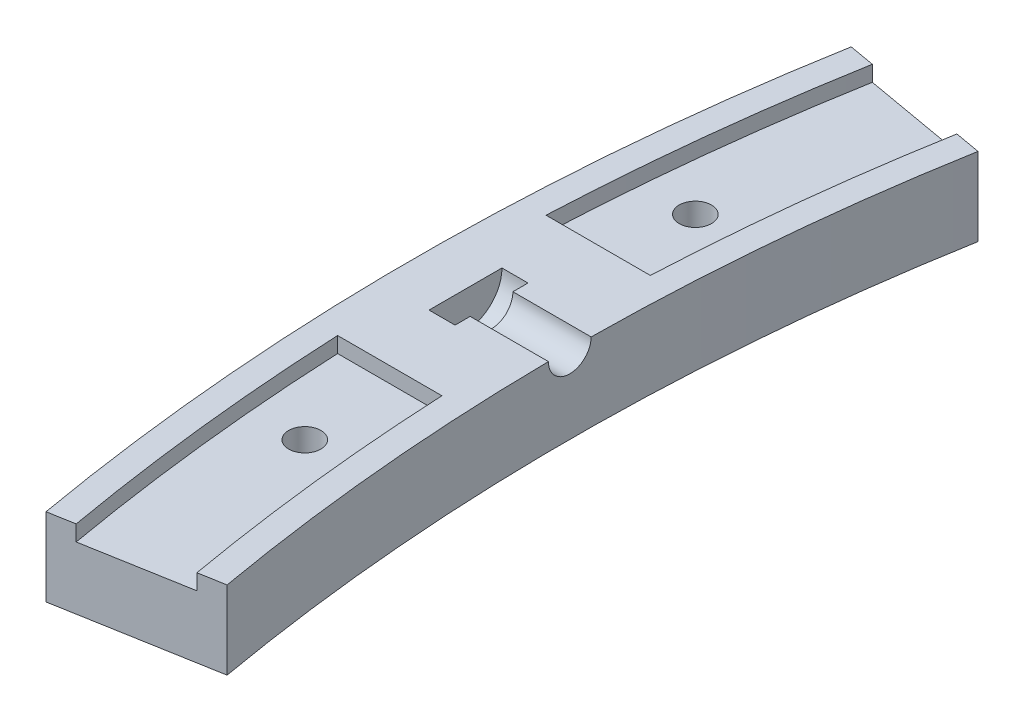
from build123d import *

# Parameters (mm, degrees)
BOSS_EXTRUDE1_DEPTH        = 7.5
CUT_EXTRUDE1_DEPTH         = 1.5
SKETCH4_R                  = 3.5
CUT_EXTRUDE3_DEPTH         = 2.5
SKETCH5_R                  = 2.05
CUT_EXTRUDE4_DEPTH         = 41.774005634
F_3_1_3_1_DIAMETER_HOLE1_D = 3.1


with BuildPart() as part:
    # Sketch1 → Boss-Extrude1 (new body)
    with BuildSketch(Plane(origin=(0, 0, 0), x_dir=(1, 0, 0), z_dir=(0, 1, 0))):
        with BuildLine():
            Line((-219.119725045, 38.636719531), (-204.34760875, 36.031996866))
            ThreePointArc((-204.34760875, 36.031996866), (-207.5, 0), (-204.34760875, -36.031996866))
            Line((-204.34760875, -36.031996866), (-219.119725045, -38.636719531))
            ThreePointArc((-219.119725045, -38.636719531), (-222.5, 0), (-219.119725045, 38.636719531))
        make_face()
    extrude(amount=BOSS_EXTRUDE1_DEPTH)

    # Sketch2 → Cut-Extrude1 (cut)
    with BuildSketch(Plane(origin=(0, 7.5, 0), x_dir=(1, 0, 0), z_dir=(0, 1, 0))):
        with BuildLine():
            Line((-206.809628133, 36.46611731), (-216.657705663, 38.202599087))
            ThreePointArc((-216.657705663, 38.202599087), (-218.670303662, 24.151569236), (-219.772609758, 10))
            Line((-219.772609758, 10), (-209.761769634, 10))
            ThreePointArc((-209.761769634, 10), (-208.70564487, 23.279901188), (-206.809628133, 36.46611731))
        make_face()
        with BuildLine():
            Line((-209.761769634, -10), (-219.772609758, -10))
            ThreePointArc((-219.772609758, -10), (-218.670303662, -24.151569236), (-216.657705663, -38.202599087))
            Line((-216.657705663, -38.202599087), (-206.809628133, -36.46611731))
            ThreePointArc((-206.809628133, -36.46611731), (-208.70564487, -23.279901188), (-209.761769634, -10))
        make_face()
    extrude(amount=-CUT_EXTRUDE1_DEPTH, mode=Mode.SUBTRACT)

    # Sketch4 → Cut-Extrude3 (cut)
    with BuildSketch(Plane(origin=(-215, 0, 0), x_dir=(0, 0, -1), z_dir=(1, 0, 0))):
        with Locations((0, 7.5)):
            Circle(SKETCH4_R)
    extrude(amount=-CUT_EXTRUDE3_DEPTH, mode=Mode.SUBTRACT)

    # Sketch5 → Cut-Extrude4 (cut, through all)
    with BuildSketch(Plane(origin=(-215, 0, 0), x_dir=(0, 0, -1), z_dir=(1, 0, 0))):
        with Locations((0, 7.5)):
            Circle(SKETCH5_R)
    extrude(amount=CUT_EXTRUDE4_DEPTH, mode=Mode.SUBTRACT)

    # Ø3.1 (3.1) Diameter Hole1 (through all)
    with Locations(Plane(origin=(0, 0, 0), x_dir=(-1, 0, 0), z_dir=(0, -1, 0))):
        with Locations((214.18186009, -18.738484691), (214.18186009, 18.738484691)):
            Hole(F_3_1_3_1_DIAMETER_HOLE1_D / 2)


solid = part.part
